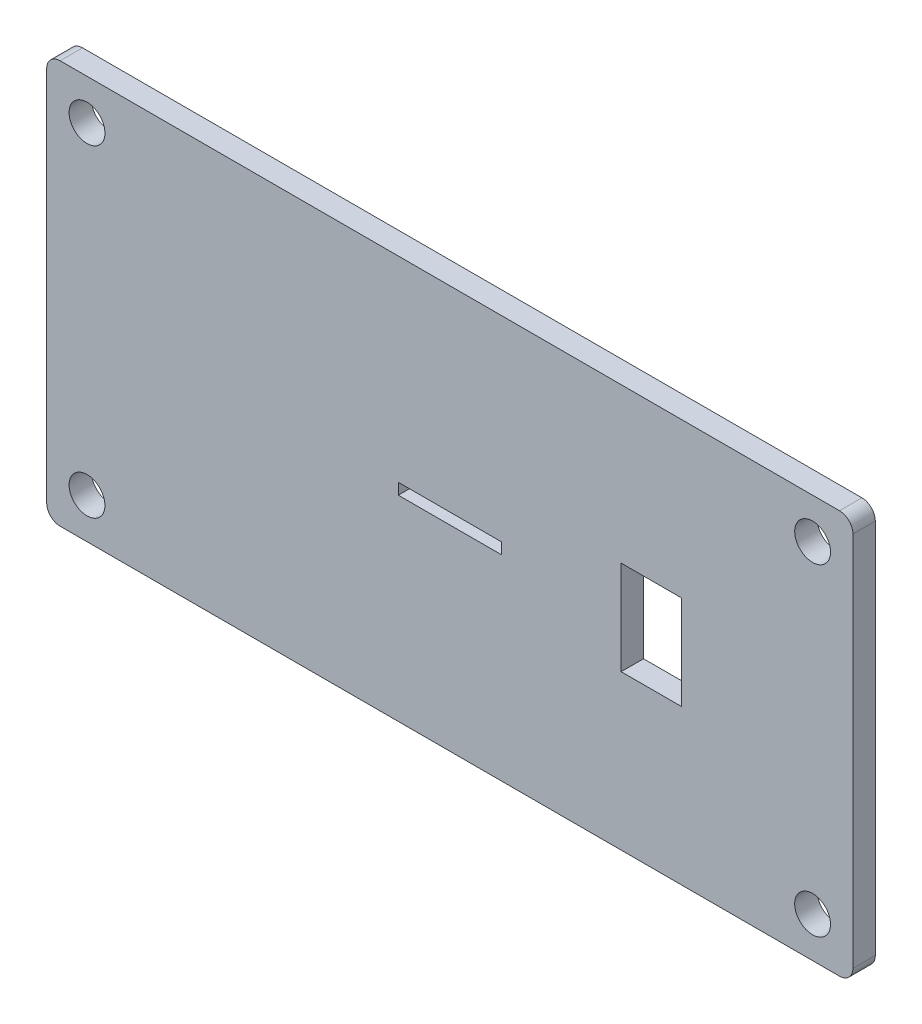
from build123d import *

# Parameters (mm, degrees)
SKETCH1_W           = 180
SKETCH1_H           = 90
BOSS_EXTRUDE1_DEPTH = 5
SKETCH2_R           = 4
CUT_EXTRUDE1_DEPTH  = 101.747208398
SKETCH3_W           = 23
SKETCH3_H           = 2.5
CUT_EXTRUDE2_DEPTH  = 101.747208398
FILLET1_R           = 3
FILLET2_R           = 3
FILLET3_R           = 3
FILLET4_R           = 3
SKETCH4_W           = 13.5
SKETCH4_H           = 21
CUT_EXTRUDE3_DEPTH  = 101.747208398


with BuildPart() as part:
    # Sketch1 → Boss-Extrude1 (new body)
    with BuildSketch(Plane.XY):
        Rectangle(SKETCH1_W, SKETCH1_H)
    extrude(amount=BOSS_EXTRUDE1_DEPTH)

    # Sketch2 → Cut-Extrude1 (cut, through all)
    with BuildSketch(Plane.XY.offset(5)):
        with Locations((-81, 36)):
            Circle(SKETCH2_R)
        with Locations(Location((81, 36, 0), (0, 0, 180))):
            Circle(SKETCH2_R)
        with Locations((81, -36)):
            Circle(SKETCH2_R)
        with Locations(Location((-81, -36, 0), (0, 0, 180))):
            Circle(SKETCH2_R)
    extrude(amount=-CUT_EXTRUDE1_DEPTH, mode=Mode.SUBTRACT)

    # Sketch3 → Cut-Extrude2 (cut, through all)
    with BuildSketch(Plane(origin=(0, 0, 0), x_dir=(-1, 0, 0), z_dir=(0, 0, -1))):
        Rectangle(SKETCH3_W, SKETCH3_H)
    extrude(amount=-CUT_EXTRUDE2_DEPTH, mode=Mode.SUBTRACT)

    # Fillet1
    fillet1_edges = [part.edges().sort_by_distance(p)[0] for p in [
        (90, 45, 2.5),
    ]]
    fillet(fillet1_edges, radius=FILLET1_R)

    # Fillet2
    fillet2_edges = [part.edges().sort_by_distance(p)[0] for p in [
        (90, -45, 2.5),
    ]]
    fillet(fillet2_edges, radius=FILLET2_R)

    # Fillet3
    fillet3_edges = [part.edges().sort_by_distance(p)[0] for p in [
        (-90, 45, 2.5),
    ]]
    fillet(fillet3_edges, radius=FILLET3_R)

    # Fillet4
    fillet4_edges = [part.edges().sort_by_distance(p)[0] for p in [
        (-90, -45, 2.5),
    ]]
    fillet(fillet4_edges, radius=FILLET4_R)

    # Sketch4 → Cut-Extrude3 (cut, through all)
    with BuildSketch(Plane.XY.offset(5)):
        with Locations((45, 0)):
            Rectangle(SKETCH4_W, SKETCH4_H)
    extrude(amount=-CUT_EXTRUDE3_DEPTH, mode=Mode.SUBTRACT)


solid = part.part
